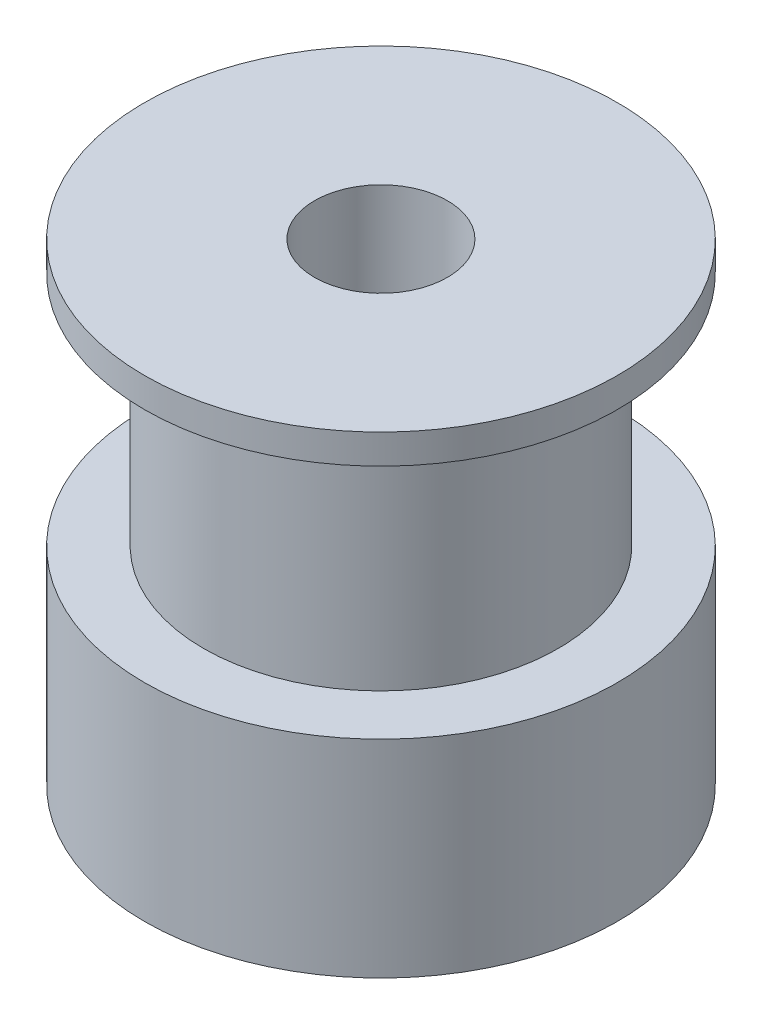
from build123d import *

# Parameters (mm, degrees)
SKETCH1_R           = 8
BOSS_EXTRUDE1_DEPTH = 7
SKETCH2_R           = 6
BOSS_EXTRUDE2_DEPTH = 8
SKETCH3_R           = 8
BOSS_EXTRUDE3_DEPTH = 1
CUT_EXTRUDE1_REACH  = 21.596
SKETCH4_R           = 2.25


with BuildPart() as part:
    # Sketch1 → Boss-Extrude1 (new body)
    with BuildSketch(Plane(origin=(0, 0, 0), x_dir=(1, 0, 0), z_dir=(0, 1, 0))):
        with Locations(Location((0, 0, 0), (0, 0, 270))):
            Circle(SKETCH1_R)
    extrude(amount=BOSS_EXTRUDE1_DEPTH)

    # Sketch2 → Boss-Extrude2 (add)
    with BuildSketch(Plane(origin=(0, 7, 0), x_dir=(1, 0, 0), z_dir=(0, 1, 0))):
        with Locations(Location((0, 0, 0), (0, 0, 270))):
            Circle(SKETCH2_R)
    extrude(amount=BOSS_EXTRUDE2_DEPTH)

    # Sketch3 → Boss-Extrude3 (add)
    with BuildSketch(Plane(origin=(0, 15, 0), x_dir=(1, 0, 0), z_dir=(0, 1, 0))):
        with Locations(Location((0, 0, 0), (0, 0, 270))):
            Circle(SKETCH3_R)
    extrude(amount=BOSS_EXTRUDE3_DEPTH)

    # Sketch4 → Cut-Extrude1 (cut, up to next)
    with BuildSketch(Plane(origin=(0, 16, 0), x_dir=(1, 0, 0), z_dir=(0, 1, 0)), mode=Mode.PRIVATE) as cut_extrude1_sk1:
        with Locations(Location((0, 0, 0), (0, 0, 270))):
            Circle(SKETCH4_R)
    cut_extrude1_tool1 = extrude(cut_extrude1_sk1.sketch, amount=-CUT_EXTRUDE1_REACH, mode=Mode.PRIVATE) & part.part
    add(cut_extrude1_tool1.solids().sort_by_distance((0, 16, 0))[0], mode=Mode.SUBTRACT)


solid = part.part
